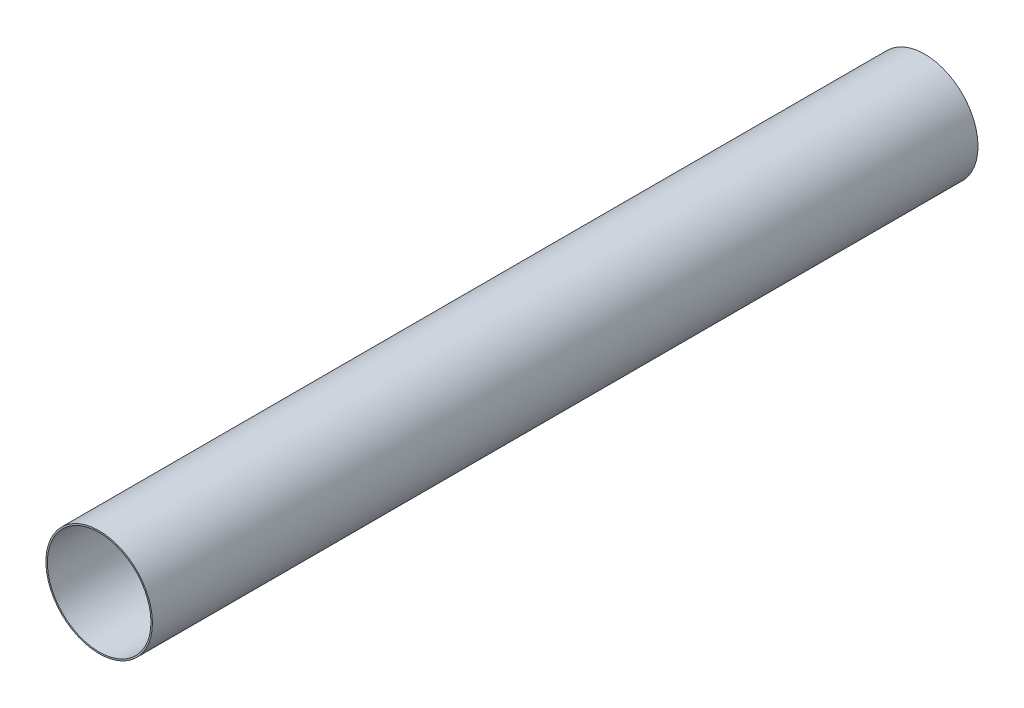
from build123d import *

# Parameters (mm, degrees)
ESQUISSE1_R        = 50.8
ESQUISSE1_R_2      = 49.403
BOSS_EXTRU_1_DEPTH = 787.4


with BuildPart() as part:
    # Esquisse1 → Boss.-Extru.1 (new body)
    with BuildSketch(Plane.XY):
        Circle(ESQUISSE1_R)
        Circle(ESQUISSE1_R_2, mode=Mode.SUBTRACT)
    extrude(amount=BOSS_EXTRU_1_DEPTH)


solid = part.part
